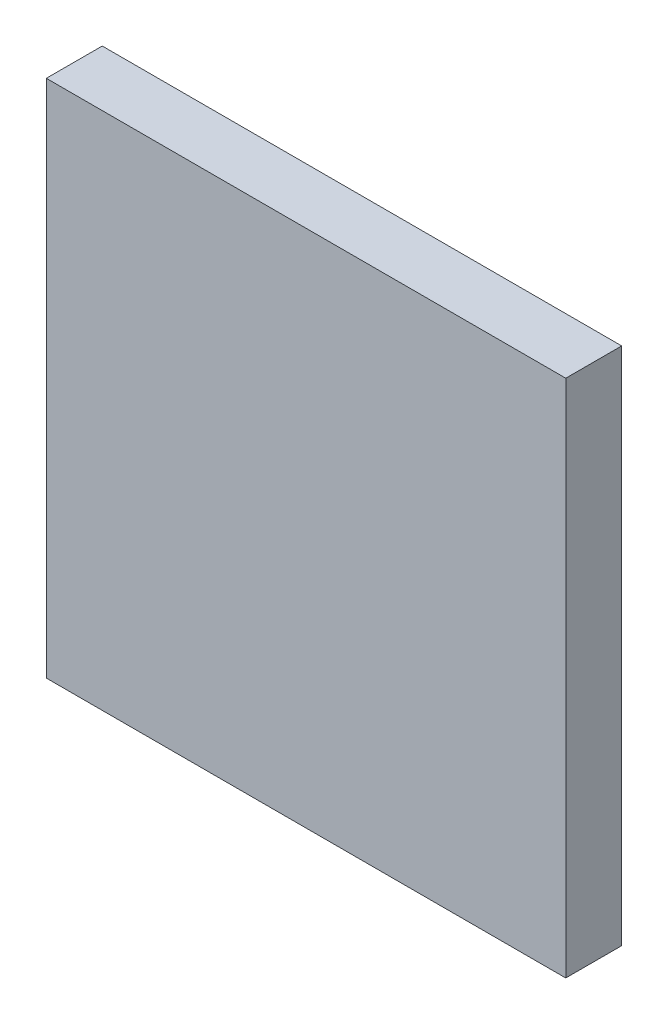
from build123d import *

# Parameters (mm, degrees)
SKETCH1_W           = 16.51
SKETCH1_H           = 16.51
BOSS_EXTRUDE1_DEPTH = 1.778


with BuildPart() as part:
    # Sketch1 → Boss-Extrude1 (new body)
    with BuildSketch(Plane.XY):
        with Locations((8.255, 8.255)):
            Rectangle(SKETCH1_W, SKETCH1_H)
    extrude(amount=BOSS_EXTRUDE1_DEPTH)


solid = part.part
